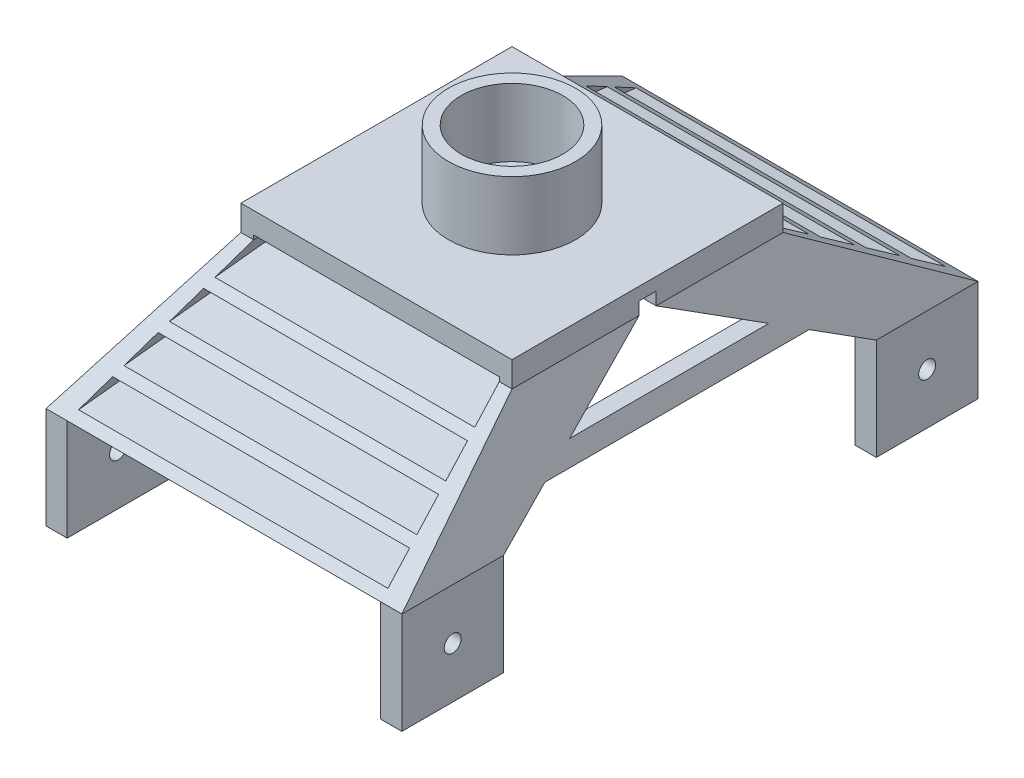
from build123d import *

# Parameters (mm, degrees)
SKETCH4_W                 = 64
SKETCH4_H                 = 64
SKETCH4_R                 = 2.5
BOSS_EXTRUDE3_DEPTH       = 3
SKETCH6_R                 = 15
SKETCH6_R_2               = 12
BOSS_EXTRUDE4_DEPTH       = 16
SKETCH8_W                 = 5
SKETCH8_H                 = 24
BOSS_EXTRUDE7_DEPTH       = 24
BOSS_EXTRUDE7_2_DEPTH     = 24
BOSS_EXTRUDE7_3_DEPTH     = 24
BOSS_EXTRUDE7_4_DEPTH     = 24
SKETCH16_R                = 2
CUT_EXTRUDE3_DEPTH        = 85
SKETCH16_2_R              = 2
CUT_EXTRUDE4_DEPTH        = 114
SKETCH12_W                = 3
SKETCH12_H                = 30
BOSS_EXTRUDE8_DEPTH       = 3
SKETCH23_W                = 58
SKETCH23_H                = 2
BOSS_EXTRUDE14_DEPTH      = 2
BOSS_EXTRUDE19_START      = -47
BOSS_EXTRUDE19_DEPTH      = 92
CUT_EXTRUDE9_DEPTH        = 95
BOSS_EXTRUDE21_START      = -37
BOSS_EXTRUDE21_DEPTH      = 81
SKETCH34_W                = 4
SKETCH34_H                = 20
BOSS_EXTRUDE23_DEPTH      = 25
BOSS_EXTRUDE24_DEPTH      = 17
BOSS_EXTRUDE24_DEPTH_BACK = 35
SKETCH34_2_W              = 4
SKETCH34_2_H              = 20


with BuildPart() as part:
    # Sketch4 → Boss-Extrude3 (new body)
    with BuildSketch(Plane(origin=(0, 0, 0), x_dir=(1, 0, 0), z_dir=(0, 1, 0))):
        Rectangle(SKETCH4_W, SKETCH4_H)
        with Locations(Location((0, 0, 0), (0, 0, 270))):
            Circle(SKETCH4_R, mode=Mode.SUBTRACT)
        with BuildLine():
            Line((-2.588190451, 9.659258263), (-2.199961883, 8.210369523))
            ThreePointArc((-2.199961883, 8.210369523), (0, 8.5), (2.199961883, 8.210369523))
            Line((2.199961883, 8.210369523), (2.588190451, 9.659258263))
            ThreePointArc((2.588190451, 9.659258263), (0, 10), (-2.588190451, 9.659258263))
        make_face(mode=Mode.SUBTRACT)
        with BuildLine():
            Line((-2.588190451, -9.659258263), (-2.199961883, -8.210369523))
            ThreePointArc((-2.199961883, -8.210369523), (0, -8.5), (2.199961883, -8.210369523))
            Line((2.199961883, -8.210369523), (2.588190451, -9.659258263))
            ThreePointArc((2.588190451, -9.659258263), (0, -10), (-2.588190451, -9.659258263))
        make_face(mode=Mode.SUBTRACT)
    extrude(amount=BOSS_EXTRUDE3_DEPTH)

    # Sketch6 → Boss-Extrude4 (add)
    with BuildSketch(Plane(origin=(0, 3, 0), x_dir=(1, 0, 0), z_dir=(0, 1, 0))):
        with Locations(Location((0, 0, 0), (0, 0, 270))):
            Circle(SKETCH6_R)
        with Locations(Location((0, 0, 0), (0, 0, 270))):
            Circle(SKETCH6_R_2, mode=Mode.SUBTRACT)
    extrude(amount=BOSS_EXTRUDE4_DEPTH)

    # Sketch12 → Boss-Extrude8 (add)
    with BuildSketch(Plane.XZ):
        with Locations((30.5, 17)):
            Rectangle(SKETCH12_W, SKETCH12_H)
        with Locations((30.5, -17)):
            Rectangle(SKETCH12_W, SKETCH12_H)
        with Locations((-30.5, 17)):
            Rectangle(SKETCH12_W, SKETCH12_H)
        with Locations((-30.5, -17)):
            Rectangle(SKETCH12_W, SKETCH12_H)
    extrude(amount=BOSS_EXTRUDE8_DEPTH)



with BuildPart() as body_2:
    # Sketch8 → Boss-Extrude7 (new body)
    with BuildSketch(Plane(origin=(0, -50, 0), x_dir=(1, 0, 0), z_dir=(0, 1, 0))):
        with Locations((39.5, -56)):
            Rectangle(SKETCH8_W, SKETCH8_H)
    extrude(amount=BOSS_EXTRUDE7_DEPTH)


with BuildPart() as body_3:
    # Sketch8 → Boss-Extrude7 2 (new body)
    with BuildSketch(Plane(origin=(0, -50, 0), x_dir=(1, 0, 0), z_dir=(0, 1, 0))):
        with Locations((-39.5, -56)):
            Rectangle(SKETCH8_W, SKETCH8_H)
    extrude(amount=BOSS_EXTRUDE7_2_DEPTH)


with BuildPart() as body_4:
    # Sketch8 → Boss-Extrude7 3 (new body)
    with BuildSketch(Plane(origin=(0, -50, 0), x_dir=(1, 0, 0), z_dir=(0, 1, 0))):
        with Locations((39.5, 56)):
            Rectangle(SKETCH8_W, SKETCH8_H)
    extrude(amount=BOSS_EXTRUDE7_3_DEPTH)


with BuildPart() as body_5:
    # Sketch8 → Boss-Extrude7 4 (new body)
    with BuildSketch(Plane(origin=(0, -50, 0), x_dir=(1, 0, 0), z_dir=(0, 1, 0))):
        with Locations((-39.5, 56)):
            Rectangle(SKETCH8_W, SKETCH8_H)
    extrude(amount=BOSS_EXTRUDE7_4_DEPTH)


with BuildPart() as cut_extrude3_tool:
    # Sketch16 → Cut-Extrude3 (new body)
    with BuildSketch(Plane(origin=(0, 0, 0), x_dir=(0, 0, -1), z_dir=(1, 0, 0))):
        with Locations((-56, -38)):
            Circle(SKETCH16_R)
        with Locations((56, -38)):
            Circle(SKETCH16_R)
    extrude(amount=-CUT_EXTRUDE3_DEPTH)


with BuildPart() as body_3_1:
    add(body_3.part)

    # Cut-Extrude3: cut by cut_extrude3_tool
    add(cut_extrude3_tool.part, mode=Mode.SUBTRACT)


with BuildPart() as body_5_1:
    add(body_5.part)

    # Cut-Extrude3: cut by cut_extrude3_tool
    add(cut_extrude3_tool.part, mode=Mode.SUBTRACT)


with BuildPart() as cut_extrude4_tool:
    # Sketch16<2> → Cut-Extrude4 (new body)
    with BuildSketch(Plane(origin=(0, 0, 0), x_dir=(0, 0, -1), z_dir=(1, 0, 0))):
        with Locations(Location((-56, -38, 0), (0, 0, 180))):
            Circle(SKETCH16_2_R)
        with Locations(Location((56, -38, 0), (0, 0, 180))):
            Circle(SKETCH16_2_R)
    extrude(amount=CUT_EXTRUDE4_DEPTH)


with BuildPart() as body_2_1:
    add(body_2.part)

    # Cut-Extrude4: cut by cut_extrude4_tool
    add(cut_extrude4_tool.part, mode=Mode.SUBTRACT)


with BuildPart() as body_4_1:
    add(body_4.part)

    # Cut-Extrude4: cut by cut_extrude4_tool
    add(cut_extrude4_tool.part, mode=Mode.SUBTRACT)


with BuildPart() as part_1:
    add(part.part)

    add(body_5_1.part)  # loft4 joins it to this body
    # loft from a face of the part (loft4)
    loft([part_1.faces().sort_by_distance((-30.5, -3, -17))[0], part_1.faces().sort_by_distance((-39.5, -26, -56))[0]])


    add(body_3_1.part)  # loft5 joins it to this body
    # loft from a face of the part (loft5)
    loft([part_1.faces().sort_by_distance((-30.5, -3, 17))[0], part_1.faces().sort_by_distance((-39.5, -26, 56))[0]])


    add(body_4_1.part)  # loft6 joins it to this body
    # loft from a face of the part (loft6)
    loft([part_1.faces().sort_by_distance((30.5, -3, -17))[0], part_1.faces().sort_by_distance((39.5, -26, -56))[0]])


    add(body_2_1.part)  # loft7 joins it to this body
    # loft from a face of the part (loft7)
    loft([part_1.faces().sort_by_distance((30.5, -3, 17))[0], part_1.faces().sort_by_distance((39.5, -26, 56))[0]])

    # Sketch23 → Boss-Extrude14 (add)
    with BuildSketch(Plane.XZ):
        with Locations((0, 31)):
            Rectangle(SKETCH23_W, SKETCH23_H)
        with Locations((0, 21)):
            Rectangle(SKETCH23_W, SKETCH23_H)
        with Locations((0, -11)):
            Rectangle(SKETCH23_W, SKETCH23_H)
        with Locations((0, 11)):
            Rectangle(SKETCH23_W, SKETCH23_H)
        with Locations((0, -21)):
            Rectangle(SKETCH23_W, SKETCH23_H)
        with Locations((0, -31)):
            Rectangle(SKETCH23_W, SKETCH23_H)
    extrude(amount=BOSS_EXTRUDE14_DEPTH)

    # Sketch30 → Boss-Extrude19 (add)
    with BuildSketch(Plane(origin=(0, 0, 0), x_dir=(0, 0, -1), z_dir=(1, 0, 0)).offset(BOSS_EXTRUDE19_START)):
        Polygon((-68, -26), (-50.881860762, -22.981610193), (-48.42567833, -21.533092349), (-65.804776844, -24.597496317), align=None)
        Polygon((-41.057131037, -17.187538817), (-59.219107376, -20.389985268), (-57.02388422, -18.987481585), (-38.600948606, -15.739020972), align=None)
        Polygon((-31.232401312, -11.39346744), (-50.438214753, -14.779970536), (-48.242991597, -13.377466853), (-28.776218881, -9.944949596), align=None)
        Polygon((-21.407671587, -5.599396064), (-41.657322129, -9.169955805), (-39.462098973, -7.767452122), (-18.951489156, -4.15087822), align=None)
    boss_extrude19 = extrude(amount=BOSS_EXTRUDE19_DEPTH)

    # Sketch31 → Cut-Extrude9 (cut)
    with BuildSketch(Plane.XY):
        Polygon((-32, -3), (-42, -26), (-54.106799644, -26), (-54.106799644, -3), align=None)
        Polygon((32, -3), (50.267603119, -3), (50.267603119, -26), (42, -26), align=None)
    cut_extrude9 = extrude(amount=CUT_EXTRUDE9_DEPTH, mode=Mode.SUBTRACT)

    # Mirror7: Boss-Extrude19, Cut-Extrude9 across plane
    add(boss_extrude19.mirror(Plane.XY))
    add(cut_extrude9.mirror(Plane.XY), mode=Mode.SUBTRACT)

    # Sketch32 → Boss-Extrude21 (add)
    with BuildSketch(Plane.XY.offset(BOSS_EXTRUDE21_START)):
        Polygon((34.56086316, -18.987481585), (38.95107895, -18.987481585), (37.12172632, -14.779970536), (33.097381056, -14.779970536), align=None)
    boss_extrude21 = extrude(amount=BOSS_EXTRUDE21_DEPTH)

    # Mirror8: Boss-Extrude21 across plane
    add(boss_extrude21.mirror(Plane(origin=(0, 0, 0), x_dir=(0, 0, 1), z_dir=(1, 0, 0))))



with BuildPart() as body_2_2:
    # Sketch34 → Boss-Extrude23 (new body)
    with BuildSketch(Plane(origin=(0, -15, 0), x_dir=(1, 0, 0), z_dir=(0, 1, 0))):
        with Locations((-7, 0)):
            Rectangle(SKETCH34_W, SKETCH34_H)
    extrude(amount=-BOSS_EXTRUDE23_DEPTH)


with BuildPart() as part_2:
    add(part_1.part)

    add(body_2_2.part)  # Boss-Extrude24 merges body 2 2
    # Sketch34<2> → Boss-Extrude24 (add, two sides: drawn at the far end of the back side and taken through both)
    with BuildSketch(Plane(origin=(0, -15, 0), x_dir=(1, 0, 0), z_dir=(0, 1, 0)).offset(-BOSS_EXTRUDE24_DEPTH_BACK)):
        with Locations((-7, 0)):
            Rectangle(SKETCH34_2_W, SKETCH34_2_H)
    extrude(amount=BOSS_EXTRUDE24_DEPTH + BOSS_EXTRUDE24_DEPTH_BACK)


solid = part_2.part
